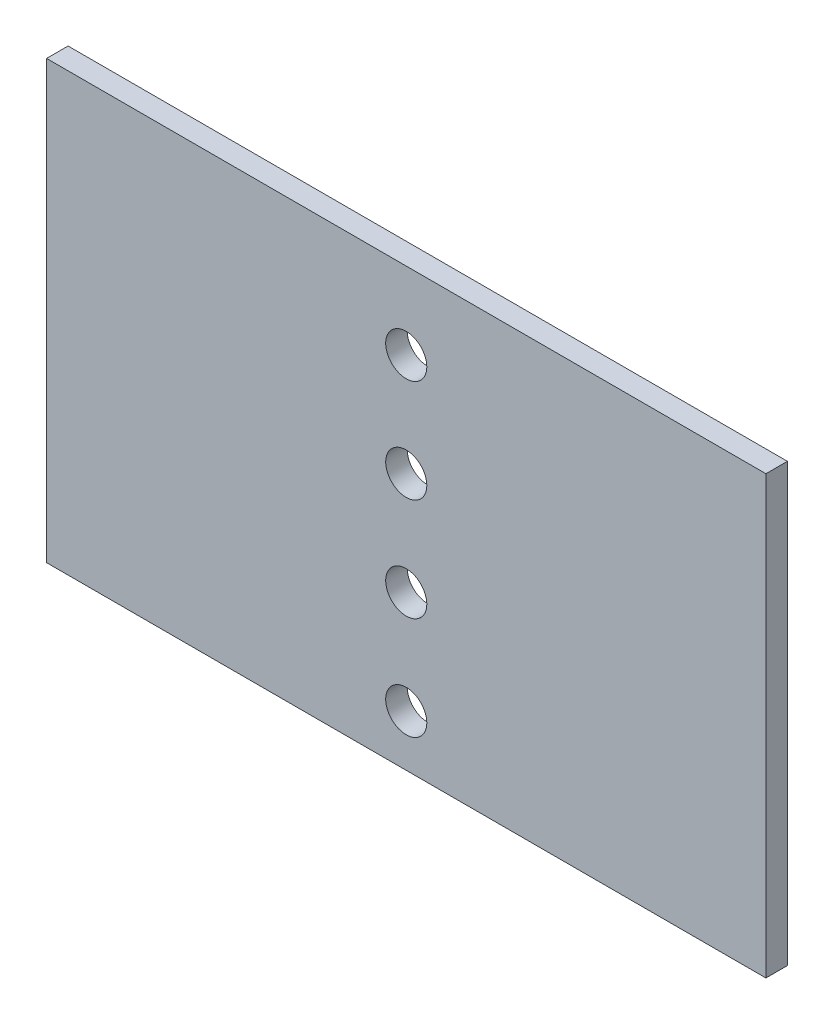
from build123d import *

# Parameters (mm, degrees)
SKETCH1_W           = 88.9
SKETCH1_H           = 53.975
BOSS_EXTRUDE1_DEPTH = 2.65684
SKETCH2_R           = 2.54
CUT_EXTRUDE1_DEPTH  = 105.036385096


with BuildPart() as part:
    # Sketch1 → Boss-Extrude1 (new body)
    with BuildSketch(Plane.XY):
        with Locations((44.45, 26.9875)):
            Rectangle(SKETCH1_W, SKETCH1_H)
    extrude(amount=BOSS_EXTRUDE1_DEPTH)

    # Sketch2 → Cut-Extrude1 (cut, through all)
    with BuildSketch(Plane.XY.offset(2.65684)):
        with Locations((44.45, 6.35)):
            Circle(SKETCH2_R)
        with Locations((44.45, 19.05)):
            Circle(SKETCH2_R)
        with Locations((44.45, 31.75)):
            Circle(SKETCH2_R)
        with Locations((44.45, 44.45)):
            Circle(SKETCH2_R)
    extrude(amount=-CUT_EXTRUDE1_DEPTH, mode=Mode.SUBTRACT)


solid = part.part
